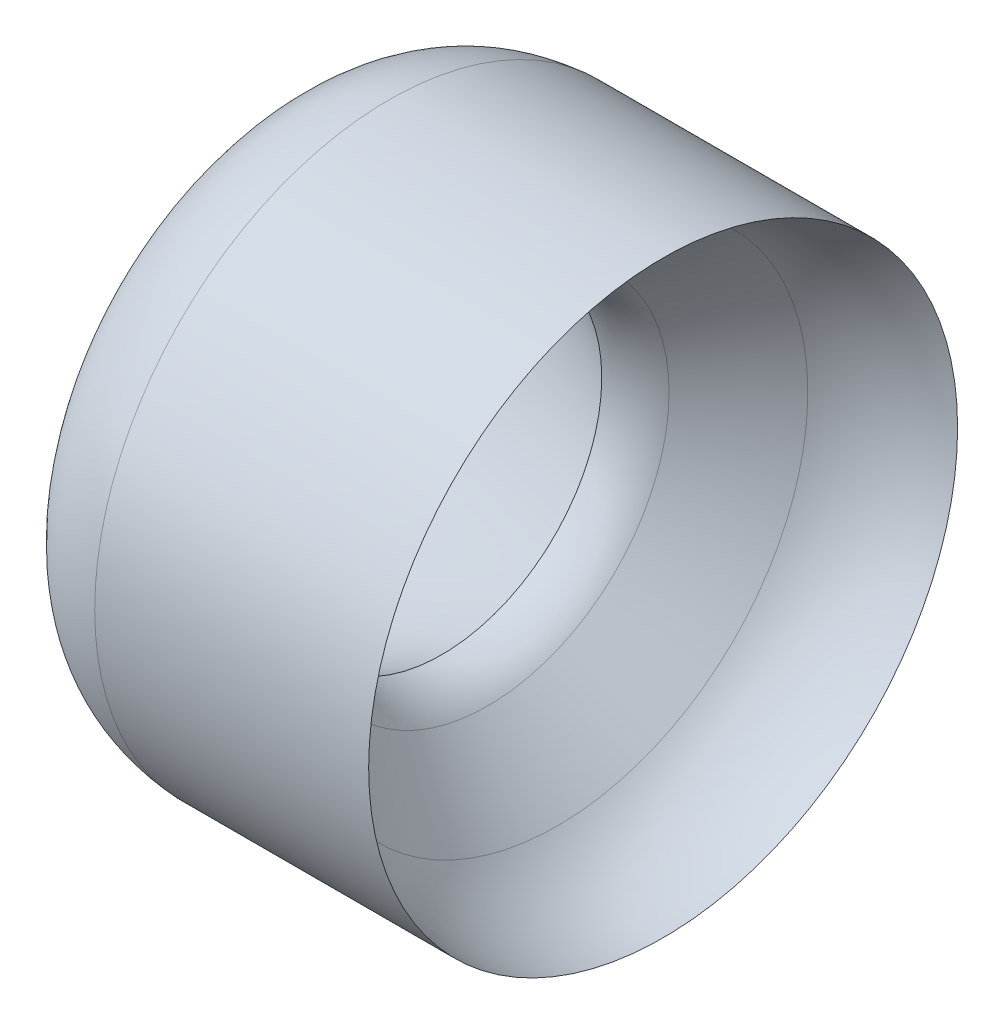
from build123d import *


with BuildPart() as part:
    # Sketch1 → Revolve1 (revolve)
    with BuildSketch(Plane.XY, mode=Mode.PRIVATE) as revolve1_sk:
        with BuildLine():
            Line((16.221314872, 30.113926078), (7.884849119, 21.777460326))
            ThreePointArc((7.884849119, 21.777460326), (5.344435892, 20.007381854), (2.348184674, 19.226769399))
            add(Edge.make_bspline(
                [(2.348184674, 19.226769399), (-7.274253669, 23.251350298), (-16.967528587, 26.440745397)],
                knots=[0, 0, 0, 1, 1, 1], degree=2))
            add(Edge.make_bspline(
                [(-3.969623677, 35.386004017), (-13.760694678, 34.624561197), (-16.967528587, 26.440745397)],
                knots=[0, 0, 0, 1, 1, 1], degree=2))
            Line((-3.969623677, 35.386004017), (28.949236933, 35.386004017))
            ThreePointArc((28.949236933, 35.386004017), (22.060935151, 34.015835602), (16.221314872, 30.113926078))
        make_face()
    revolve(revolve1_sk.sketch.rotate(Axis((-206.148150747, 0, 0), (1, 0, 0)), 90), axis=Axis((-206.148150747, 0, 0), (1, 0, 0)))


solid = part.part
